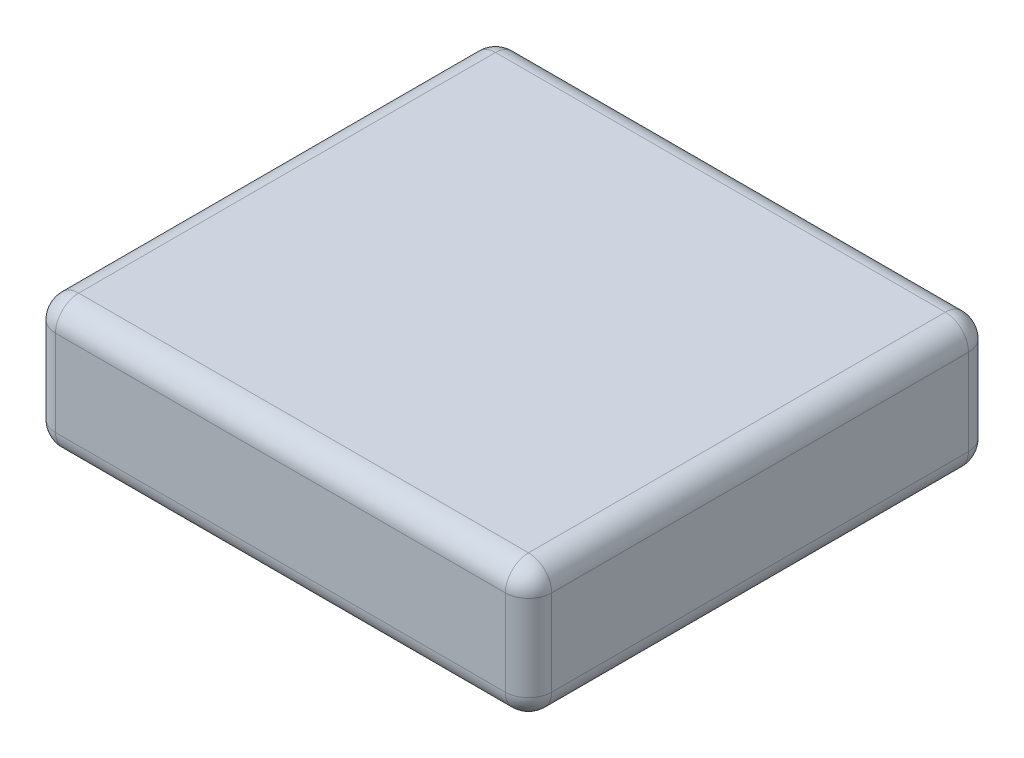
from build123d import *

# Parameters (mm, degrees)
SKETCH1_W           = 750
SKETCH1_H           = 700
BOSS_EXTRUDE1_DEPTH = 200
FILLET1_R           = 35


with BuildPart() as part:
    # Sketch1 → Boss-Extrude1 (new body)
    with BuildSketch(Plane(origin=(0, 0, 0), x_dir=(1, 0, 0), z_dir=(0, 1, 0))):
        with Locations((375, 350)):
            Rectangle(SKETCH1_W, SKETCH1_H)
    extrude(amount=BOSS_EXTRUDE1_DEPTH)

    # Fillet1
    fillet1_edges = [part.edges().sort_by_distance(p)[0] for p in [
        (750, 200, -350),
        (375, 200, -700),
        (0, 200, -350),
        (375, 0, -700),
        (750, 0, -350),
        (375, 0, 0),
        (0, 0, -350),
        (375, 200, 0),
        (0, 100, -700),
        (750, 100, -700),
        (750, 100, 0),
        (0, 100, 0),
    ]]
    fillet(fillet1_edges, radius=FILLET1_R)


solid = part.part
